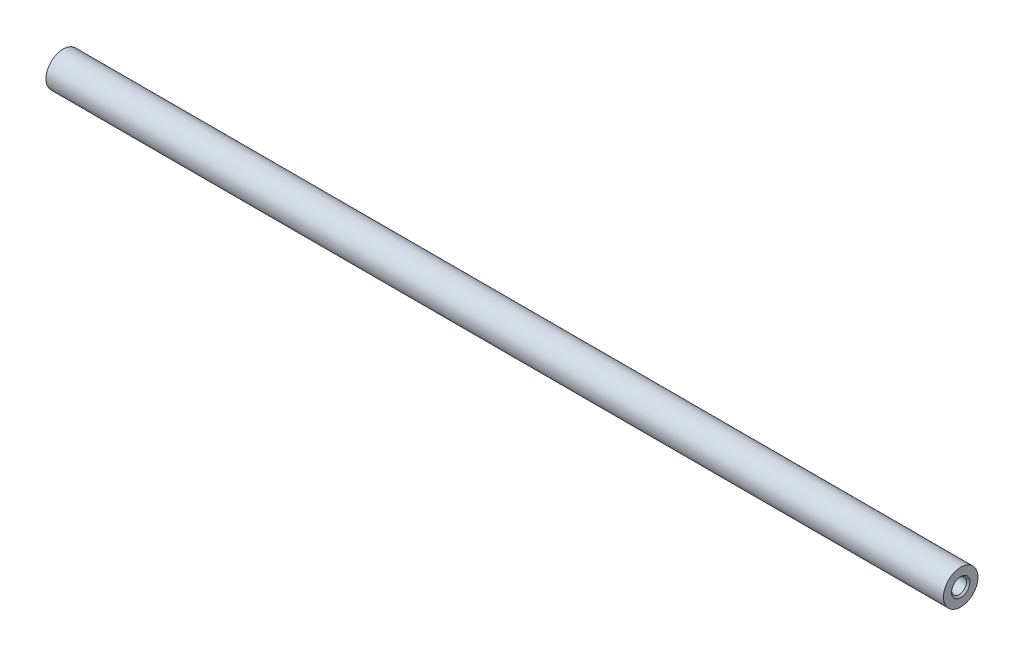
from build123d import *

# Parameters (mm, degrees)
SKETCH_1_R          = 10
EXTRUDE_1_DEPTH     = 520
SKETCH_2_R          = 4.3
CUT_EXTRUDE_2_DEPTH = 25
CHAMFER_1_SIZE      = 1


with BuildPart() as part:
    # 草图1 → 拉伸1 (new body)
    with BuildSketch(Plane(origin=(0, 0, 0), x_dir=(0, 0, -1), z_dir=(1, 0, 0))):
        Circle(SKETCH_1_R)
    extrude(amount=EXTRUDE_1_DEPTH)

    # 草图2 → 拉伸2 (cut)
    with BuildSketch(Plane(origin=(520, 0, 0), x_dir=(0, 0, -1), z_dir=(1, 0, 0))):
        Circle(SKETCH_2_R)
    extrude(amount=-CUT_EXTRUDE_2_DEPTH, mode=Mode.SUBTRACT)

    # 倒角1
    chamfer_1_edges = [part.edges().sort_by_distance(p)[0] for p in [
        (520, 0, 4.3),
    ]]
    chamfer(chamfer_1_edges, length=CHAMFER_1_SIZE)


solid = part.part
